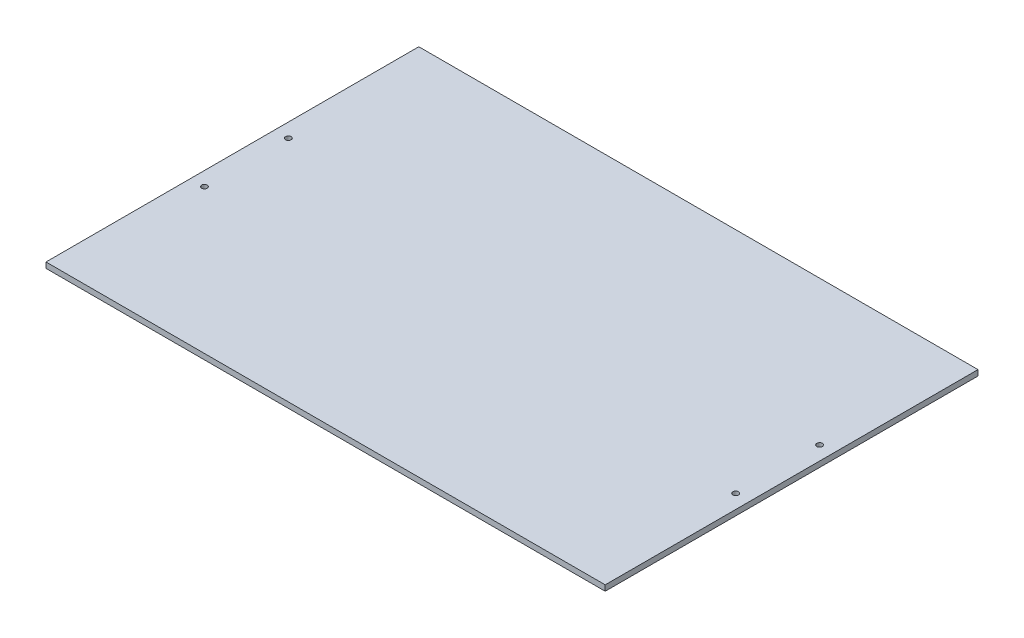
from build123d import *

# Parameters (mm, degrees)
ESBO_O1_W                = 300
ESBO_O1_H                = 200
ESBO_O1_R                = 1.5
RESSALTO_EXTRUS_O1_DEPTH = 3


with BuildPart() as part:
    # Esboço1 → Ressalto-extrusão1 (new body)
    with BuildSketch(Plane(origin=(0, 0, 0), x_dir=(1, 0, 0), z_dir=(0, 1, 0))):
        Rectangle(ESBO_O1_W, ESBO_O1_H)
        with Locations(Location((-142.5, 22.5, 0), (0, 0, 270))):
            Circle(ESBO_O1_R, mode=Mode.SUBTRACT)
        with Locations(Location((-142.5, -22.5, 0), (0, 0, 270))):
            Circle(ESBO_O1_R, mode=Mode.SUBTRACT)
        with Locations(Location((142.5, -22.5, 0), (0, 0, 90))):
            Circle(ESBO_O1_R, mode=Mode.SUBTRACT)
        with Locations(Location((142.5, 22.5, 0), (0, 0, 90))):
            Circle(ESBO_O1_R, mode=Mode.SUBTRACT)
    extrude(amount=RESSALTO_EXTRUS_O1_DEPTH)


solid = part.part
